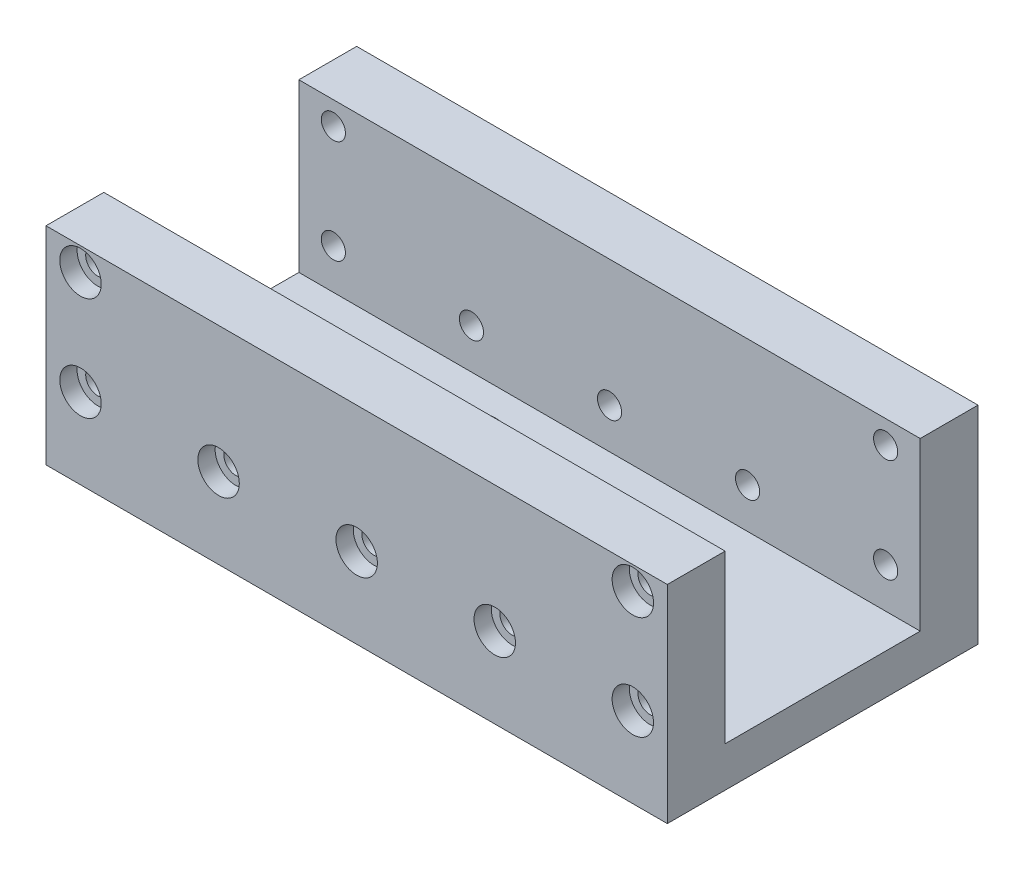
from build123d import *

# Parameters (mm, degrees)
SKETCH1_W           = 108
SKETCH1_H           = 54
BOSS_EXTRUDE1_DEPTH = 6
SKETCH2_R           = 2
CUT_EXTRUDE1_DEPTH  = 12
SKETCH3_R           = 3.5
CUT_EXTRUDE3_DEPTH  = 4
SKETCH4_W           = 108
SKETCH4_H           = 54
BOSS_EXTRUDE2_DEPTH = 30
SKETCH5_W           = 108
SKETCH5_H           = 33.9
CUT_EXTRUDE4_DEPTH  = 29
SKETCH6_R           = 2.1
CUT_EXTRUDE5_DEPTH  = 67
SKETCH7_R           = 3.6
CUT_EXTRUDE6_DEPTH  = 3
CUT_EXTRUDE7_DEPTH  = 3
CUT_EXTRUDE8_START  = -3
SKETCH10_R          = 3.5
CUT_EXTRUDE8_DEPTH  = 3
SKETCH11_R          = 4
CUT_EXTRUDE9_DEPTH  = 10


with BuildPart() as part:
    # Sketch1 → Boss-Extrude1 (new body)
    with BuildSketch(Plane(origin=(0, 0, 0), x_dir=(1, 0, 0), z_dir=(0, 1, 0))):
        Rectangle(SKETCH1_W, SKETCH1_H)
    extrude(amount=BOSS_EXTRUDE1_DEPTH)

    # Sketch2 → Cut-Extrude1 (cut)
    with BuildSketch(Plane(origin=(0, 6, 0), x_dir=(1, 0, 0), z_dir=(0, 1, 0))):
        with Locations(Location((-14.938938215, 8.625, 0), (0, 0, 270))):
            Circle(SKETCH2_R)
        with Locations(Location((-14.938938215, -8.625, 0), (0, 0, 270))):
            Circle(SKETCH2_R)
        with Locations(Location((15.385610645, 7.800351601, 0), (0, 0, 270))):
            Circle(SKETCH2_R)
        with Locations(Location((15.385610645, -8.625, 0), (0, 0, 270))):
            Circle(SKETCH2_R)
    extrude(amount=-CUT_EXTRUDE1_DEPTH, mode=Mode.SUBTRACT)

    # Sketch3 → Cut-Extrude3 (cut)
    with BuildSketch(Plane(origin=(0, 6, 0), x_dir=(1, 0, 0), z_dir=(0, 1, 0))):
        with Locations(Location((-14.938938215, 8.625, 0), (0, 0, 270))):
            Circle(SKETCH3_R)
        with Locations(Location((-14.938938215, -8.625, 0), (0, 0, 270))):
            Circle(SKETCH3_R)
        with Locations(Location((15.385610645, 7.800351601, 0), (0, 0, 270))):
            Circle(SKETCH3_R)
        with Locations(Location((15.385610645, -8.625, 0), (0, 0, 270))):
            Circle(SKETCH3_R)
    extrude(amount=-CUT_EXTRUDE3_DEPTH, mode=Mode.SUBTRACT)

    # Sketch4 → Boss-Extrude2 (add)
    with BuildSketch(Plane(origin=(0, 6, 0), x_dir=(1, 0, 0), z_dir=(0, 1, 0))):
        Rectangle(SKETCH4_W, SKETCH4_H)
    extrude(amount=BOSS_EXTRUDE2_DEPTH)

    # Sketch5 → Cut-Extrude4 (cut)
    with BuildSketch(Plane(origin=(0, 36, 0), x_dir=(1, 0, 0), z_dir=(0, 1, 0))):
        Rectangle(SKETCH5_W, SKETCH5_H)
    extrude(amount=-CUT_EXTRUDE4_DEPTH, mode=Mode.SUBTRACT)

    # Sketch6 → Cut-Extrude5 (cut)
    with BuildSketch(Plane.XY.offset(27)):
        with Locations((0, 14)):
            Circle(SKETCH6_R)
        with Locations((-24, 14)):
            Circle(SKETCH6_R)
        with Locations((-48, 14)):
            Circle(SKETCH6_R)
        with Locations((24, 14)):
            Circle(SKETCH6_R)
        with Locations((48, 14)):
            Circle(SKETCH6_R)
        with Locations((48, 32)):
            Circle(SKETCH6_R)
        with Locations((-48, 32)):
            Circle(SKETCH6_R)
    extrude(amount=-CUT_EXTRUDE5_DEPTH, mode=Mode.SUBTRACT)

    # Sketch7 → Cut-Extrude6 (cut)
    with BuildSketch(Plane.XY.offset(27)):
        with Locations((-48, 32)):
            Circle(SKETCH7_R)
        with Locations((-48, 14)):
            Circle(SKETCH7_R)
        with Locations((-24, 14)):
            Circle(SKETCH7_R)
        with Locations((0, 14)):
            Circle(SKETCH7_R)
        with Locations((24, 14)):
            Circle(SKETCH7_R)
        with Locations((48, 14)):
            Circle(SKETCH7_R)
        with Locations((48, 32)):
            Circle(SKETCH7_R)
    extrude(amount=-CUT_EXTRUDE6_DEPTH, mode=Mode.SUBTRACT)

    # Sketch8 → Cut-Extrude7 (cut)
    with BuildSketch(Plane(origin=(0, 0, -27), x_dir=(-1, 0, 0), z_dir=(0, 0, -1))):
        Polygon((-50.020725942, 28.5), (-45.979274058, 28.5), (-43.958548116, 32), (-45.979274058, 35.5), (-50.020725942, 35.5), (-52.041451884, 32), align=None)
        Polygon((-50.020725942, 10.5), (-45.979274058, 10.5), (-43.958548116, 14), (-45.979274058, 17.5), (-50.020725942, 17.5), (-52.041451884, 14), align=None)
        Polygon((-26.020725942, 10.5), (-21.979274058, 10.5), (-19.958548116, 14), (-21.979274058, 17.5), (-26.020725942, 17.5), (-28.041451884, 14), align=None)
        Polygon((-2.020725942, 10.5), (2.020725942, 10.5), (4.041451884, 14), (2.020725942, 17.5), (-2.020725942, 17.5), (-4.041451884, 14), align=None)
        Polygon((21.979274058, 10.5), (26.020725942, 10.5), (28.041451884, 14), (26.020725942, 17.5), (21.979274058, 17.5), (19.958548116, 14), align=None)
        Polygon((45.979274058, 10.5), (50.020725942, 10.5), (52.041451884, 14), (50.020725942, 17.5), (45.979274058, 17.5), (43.958548116, 14), align=None)
        Polygon((45.979274058, 28.5), (50.020725942, 28.5), (52.041451884, 32), (50.020725942, 35.5), (45.979274058, 35.5), (43.958548116, 32), align=None)
    extrude(amount=-CUT_EXTRUDE7_DEPTH, mode=Mode.SUBTRACT)

    # Sketch10 → Cut-Extrude8 (cut)
    with BuildSketch(Plane.XZ.offset(-6).offset(CUT_EXTRUDE8_START)):
        with Locations(Location((-14.938938215, -8.625, 0), (0, 0, 90))):
            Circle(SKETCH10_R)
        with Locations(Location((-14.938938215, 8.625, 0), (0, 0, 90))):
            Circle(SKETCH10_R)
        with Locations(Location((15.385610645, 8.625, 0), (0, 0, 90))):
            Circle(SKETCH10_R)
        with Locations(Location((15.385610645, -7.800351601, 0), (0, 0, 90))):
            Circle(SKETCH10_R)
    extrude(amount=CUT_EXTRUDE8_DEPTH, mode=Mode.SUBTRACT)

    # Sketch11 → Cut-Extrude9 (cut)
    with BuildSketch(Plane(origin=(0, 7, 0), x_dir=(1, 0, 0), z_dir=(0, 1, 0))):
        with Locations(Location((0, 0, 0), (0, 0, 270))):
            Circle(SKETCH11_R)
    extrude(amount=-CUT_EXTRUDE9_DEPTH, mode=Mode.SUBTRACT)


solid = part.part
